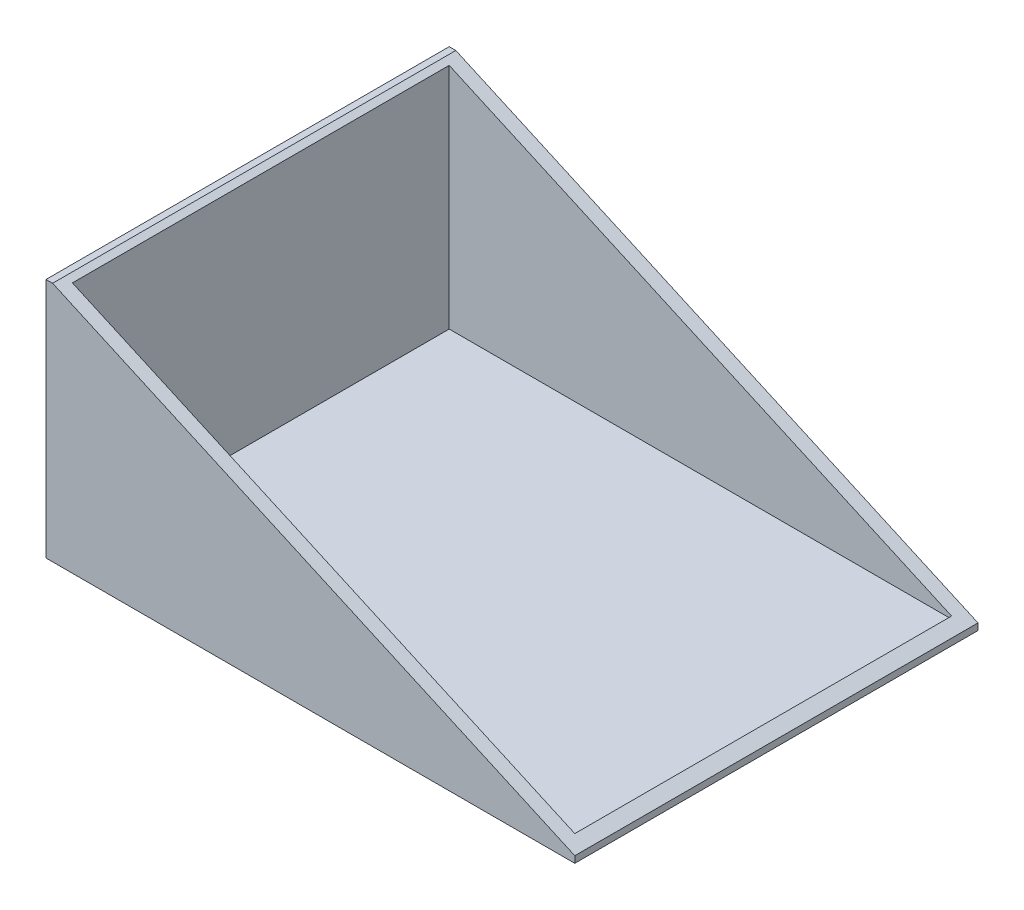
from build123d import *

# Parameters (mm, degrees)
SKETCH_1_W          = 80
SKETCH_1_H          = 61
EXTRUDE_1_DEPTH     = 1.5
SKETCH_5_W          = 80
SKETCH_5_H          = 61
SKETCH_5_W_2        = 76
SKETCH_5_H_2        = 57
EXTRUDE_3_DEPTH     = 35
CUT_EXTRUDE_2_DEPTH = 108.01985797


with BuildPart() as part:
    # 草图1 → 凸台-拉伸1 (new body)
    with BuildSketch(Plane(origin=(0, 0, 0), x_dir=(1, 0, 0), z_dir=(0, 1, 0))):
        with Locations((40, 30.5)):
            Rectangle(SKETCH_1_W, SKETCH_1_H)
    extrude(amount=EXTRUDE_1_DEPTH)

    # 草图5 → 凸台-拉伸3 (add)
    with BuildSketch(Plane(origin=(0, 1.5, 0), x_dir=(1, 0, 0), z_dir=(0, 1, 0))):
        with Locations((40, 30.5)):
            Rectangle(SKETCH_5_W, SKETCH_5_H)
        with Locations((40, 30.5)):
            Rectangle(SKETCH_5_W_2, SKETCH_5_H_2, mode=Mode.SUBTRACT)
    extrude(amount=EXTRUDE_3_DEPTH)

    # 草图6 → 切除-拉伸2 (cut, through all)
    with BuildSketch(Plane.XY):
        Polygon((1, 36.5), (80, 36.5), (80, 1), align=None)
    extrude(amount=-CUT_EXTRUDE_2_DEPTH, mode=Mode.SUBTRACT)


solid = part.part
